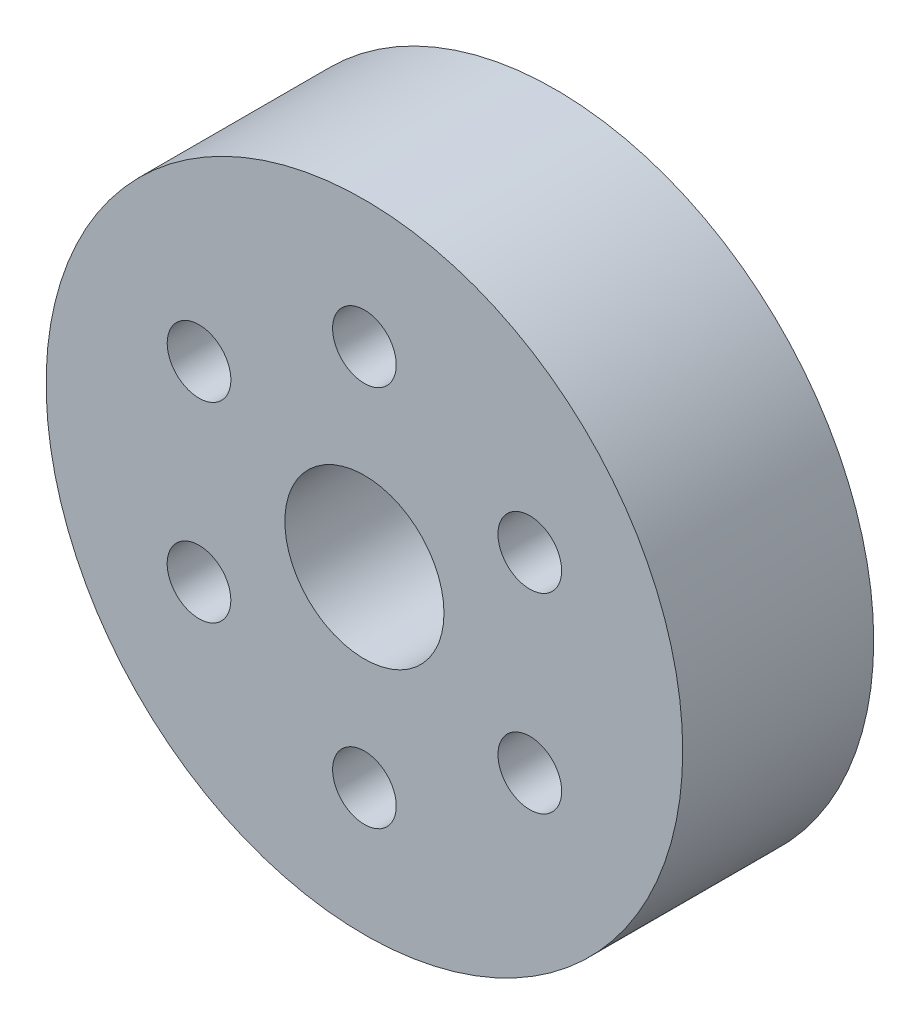
from build123d import *

# Parameters (mm, degrees)
SKETCH2_R           = 50
SKETCH2_R_2         = 12.5
BOSS_EXTRUDE1_DEPTH = 15
SKETCH6_R           = 5
CUT_EXTRUDE2_DEPTH  = 77.811457479
CIRPATTERN2_COUNT   = 6


with BuildPart() as part:
    # Sketch2 → Boss-Extrude1 (new, symmetric)
    with BuildSketch(Plane.XY):
        Circle(SKETCH2_R)
        Circle(SKETCH2_R_2, mode=Mode.SUBTRACT)
    extrude(amount=BOSS_EXTRUDE1_DEPTH, both=True)

    # Sketch6 → Cut-Extrude2 (cut, through all)
    with BuildSketch(Plane.XY.offset(15)):
        with Locations((0, 30)):
            Circle(SKETCH6_R)
    cut_extrude2 = extrude(amount=-CUT_EXTRUDE2_DEPTH, mode=Mode.SUBTRACT)

    # CirPattern2: Cut-Extrude2 ×6 about axis
    cirpattern2_axis = Axis((0, 0, 0), (0, 0, 1))
    for i in range(1, CIRPATTERN2_COUNT):
        add(cut_extrude2.rotate(cirpattern2_axis, i * 360 / CIRPATTERN2_COUNT), mode=Mode.SUBTRACT)


solid = part.part
